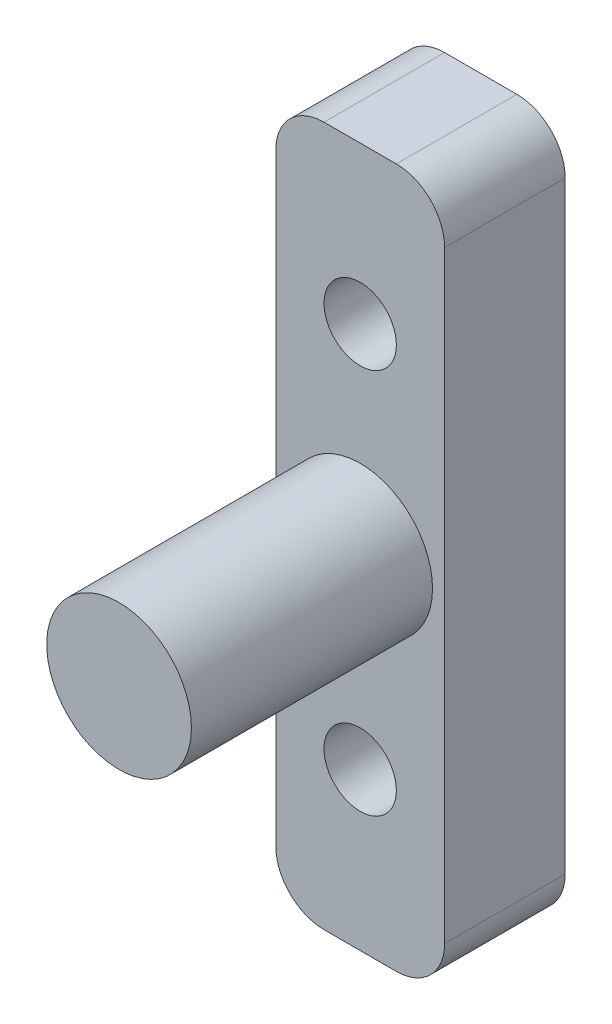
from build123d import *

# Parameters (mm, degrees)
BOSS_EXTRUDE1_DEPTH = 5
SKETCH2_R           = 3
BOSS_EXTRUDE2_DEPTH = 10
SKETCH3_R           = 1.5
CUT_EXTRUDE1_DEPTH  = 19.953891421


with BuildPart() as part:
    # Sketch1 → Boss-Extrude1 (new body)
    with BuildSketch(Plane.XY):
        with BuildLine():
            Line((0, -12.5), (0, 12.5))
            ThreePointArc((0, 12.5), (0.585786438, 13.914213562), (2, 14.5))
            Line((2, 14.5), (5, 14.5))
            ThreePointArc((5, 14.5), (6.414213562, 13.914213562), (7, 12.5))
            Line((7, 12.5), (7, -12.5))
            ThreePointArc((7, -12.5), (6.414213562, -13.914213562), (5, -14.5))
            Line((5, -14.5), (2, -14.5))
            ThreePointArc((2, -14.5), (0.585786438, -13.914213562), (0, -12.5))
        make_face()
    extrude(amount=BOSS_EXTRUDE1_DEPTH)

    # Sketch2 → Boss-Extrude2 (add)
    with BuildSketch(Plane.XY.offset(5)):
        with Locations((3.5, 0)):
            Circle(SKETCH2_R)
    extrude(amount=BOSS_EXTRUDE2_DEPTH)

    # Sketch3 → Cut-Extrude1 (cut, through all)
    with BuildSketch(Plane.XY.offset(5)):
        with Locations((3.5, 8)):
            Circle(SKETCH3_R)
        with Locations((3.5, -8)):
            Circle(SKETCH3_R)
    extrude(amount=-CUT_EXTRUDE1_DEPTH, mode=Mode.SUBTRACT)


solid = part.part
